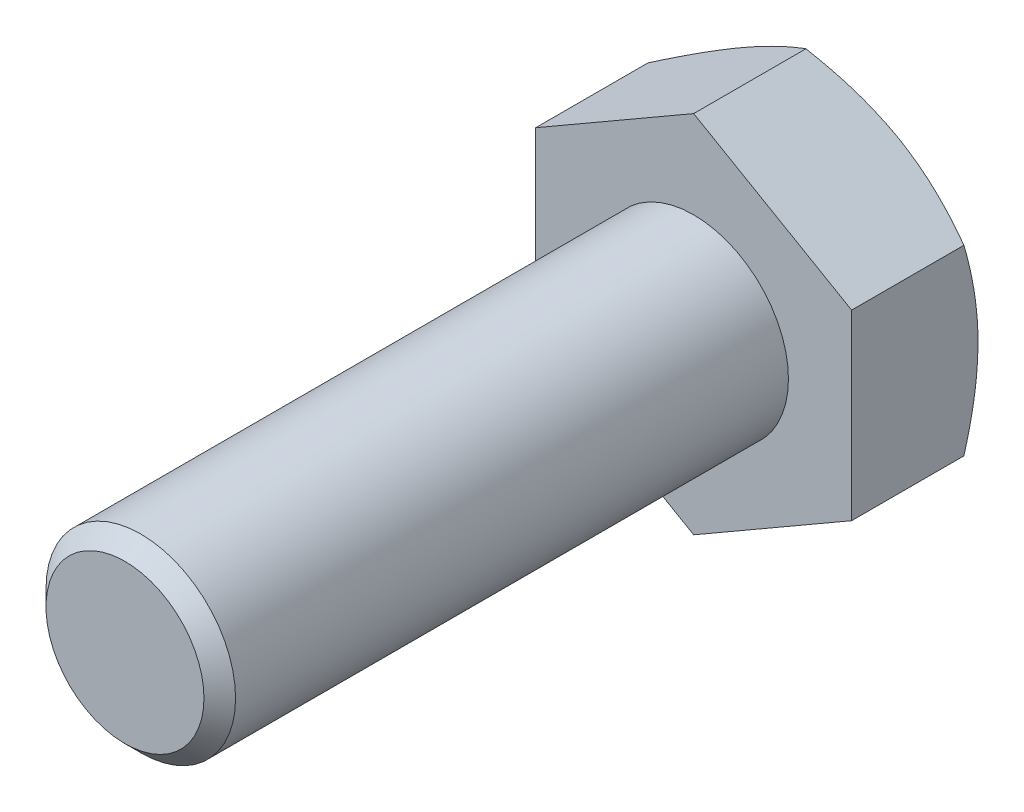
from build123d import *

# Parameters (mm, degrees)
BOSS_EXTRUDE1_DEPTH = 4
SKETCH2_R           = 3
BOSS_EXTRUDE2_DEPTH = 18
SKETCH6_OUTSIDE_W   = 101.492
SKETCH6_OUTSIDE_H   = 103.04
SKETCH6_OUTSIDE_R   = 5
CUT_EXTRUDE1_DEPTH  = 24.2880513
CUT_EXTRUDE1_DRAFT  = -60
CHAMFER1_SIZE       = 0.5


with BuildPart() as part:
    # Sketch1 → Boss-Extrude1 (new body)
    with BuildSketch(Plane.XY):
        Polygon((0, -5.773502692), (5, -2.886751346), (5, 2.886751346), (0, 5.773502692), (-5, 2.886751346), (-5, -2.886751346), align=None)
    extrude(amount=BOSS_EXTRUDE1_DEPTH)

    # Sketch2 → Boss-Extrude2 (add)
    with BuildSketch(Plane.XY.offset(4)):
        Circle(SKETCH2_R)
    extrude(amount=BOSS_EXTRUDE2_DEPTH)


with BuildPart() as cut_extrude1_tool:
    # Sketch6 outside → Cut-Extrude1 (with draft: the straight prism first)
    with BuildSketch(Plane(origin=(0, 0, 0), x_dir=(-1, 0, 0), z_dir=(0, 0, -1))):
        Rectangle(SKETCH6_OUTSIDE_W, SKETCH6_OUTSIDE_H)
        Circle(SKETCH6_OUTSIDE_R, mode=Mode.SUBTRACT)
    extrude(amount=-CUT_EXTRUDE1_DEPTH)
    # Cut-Extrude1: the draft: its side faces are tilted about the plane it starts from
    cut_extrude1_sides = [cut_extrude1_tool.faces().sort_by_distance(p)[0] for p in [
        (0, -51.52, 12.14402565),
        (-50.746, 0, 12.14402565),
        (0, 51.52, 12.14402565),
        (50.746, 0, 12.14402565),
        (5, 0, 12.14402565),
    ]]
    draft(cut_extrude1_sides, Plane(origin=(0, 0, 0), x_dir=(-1, 0, 0), z_dir=(0, 0, -1)), CUT_EXTRUDE1_DRAFT)


with BuildPart() as part_1:
    add(part.part)

    # Cut-Extrude1: cut by cut_extrude1_tool
    add(cut_extrude1_tool.part, mode=Mode.SUBTRACT)

    # Chamfer1
    chamfer1_edges = [part_1.edges().sort_by_distance(p)[0] for p in [
        (-3, 0, 22),
    ]]
    chamfer(chamfer1_edges, length=CHAMFER1_SIZE)


solid = part_1.part
